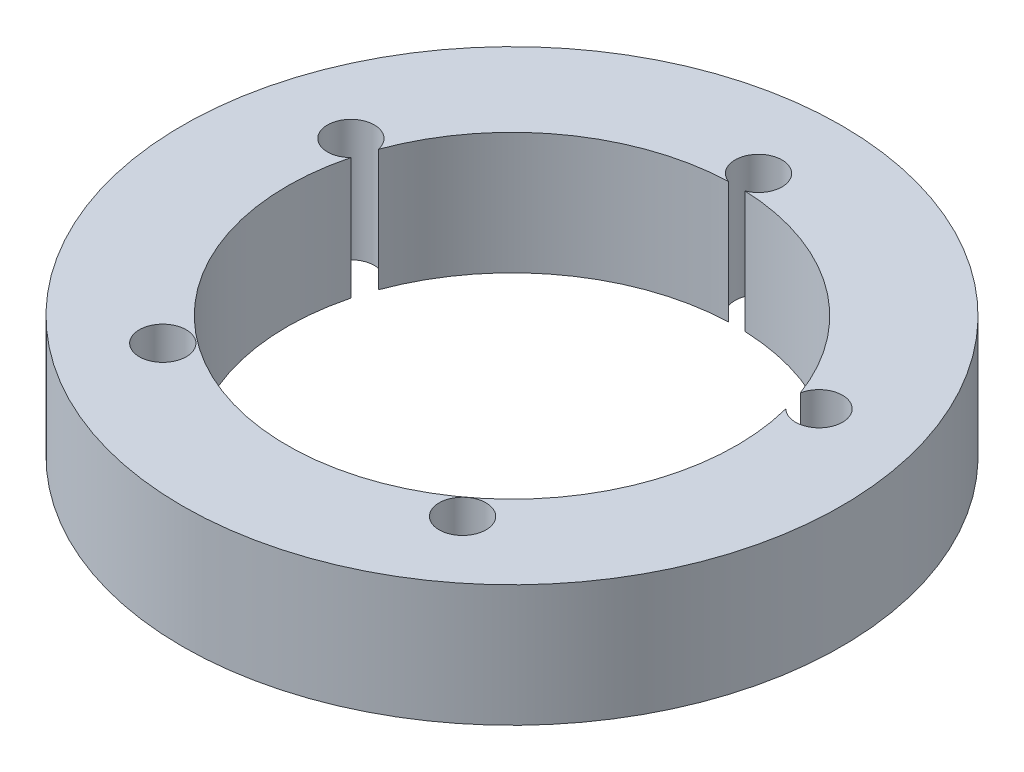
from build123d import *

# Parameters (mm, degrees)
SKETCH_1_R          = 35.2
SKETCH_1_R_2        = 24
EXTRUDE_1_DEPTH     = 13
SKETCH_2_R          = 2.505
CUT_EXTRUDE_1_DEPTH = 16
SKETCH_11_R         = 2.505
CUT_EXTRUDE_3_DEPTH = 16
SKETCH_12_R         = 2.505
CUT_EXTRUDE_4_DEPTH = 16


with BuildPart() as part:
    # 草圖1 → 伸長-薄件1 (new body)
    with BuildSketch(Plane(origin=(0, 0, 0), x_dir=(1, 0, 0), z_dir=(0, 1, 0))):
        Circle(SKETCH_1_R)
        Circle(SKETCH_1_R_2, mode=Mode.SUBTRACT)
    extrude(amount=EXTRUDE_1_DEPTH)

    # 草圖2 → 除料-伸長1 (cut)
    with BuildSketch(Plane(origin=(0, 0, 0), x_dir=(1, 0, 0), z_dir=(0, 1, 0))):
        with Locations((0, 26.330818465)):
            Circle(SKETCH_2_R)
    extrude(amount=CUT_EXTRUDE_1_DEPTH, mode=Mode.SUBTRACT)

    # 草圖11 → 除料-伸長3 (cut)
    with BuildSketch(Plane(origin=(0, 13, 0), x_dir=(1, 0, 0), z_dir=(0, 1, 0))):
        with Locations(Location((-16.103145177, -21.195220814, 0), (0, 0, 270))):
            Circle(SKETCH_11_R)
        with Locations(Location((15.916854823, -21.195220814, 0), (0, 0, 270))):
            Circle(SKETCH_11_R)
    extrude(amount=-CUT_EXTRUDE_3_DEPTH, mode=Mode.SUBTRACT)

    # 草圖12 → 除料-伸長4 (cut)
    with BuildSketch(Plane(origin=(0, 13, 0), x_dir=(1, 0, 0), z_dir=(0, 1, 0))):
        with Locations((-24.999999999, 7.794477134)):
            Circle(SKETCH_12_R)
        with Locations((25.000000001, 7.794477134)):
            Circle(SKETCH_12_R)
    extrude(amount=-CUT_EXTRUDE_4_DEPTH, mode=Mode.SUBTRACT)


solid = part.part
